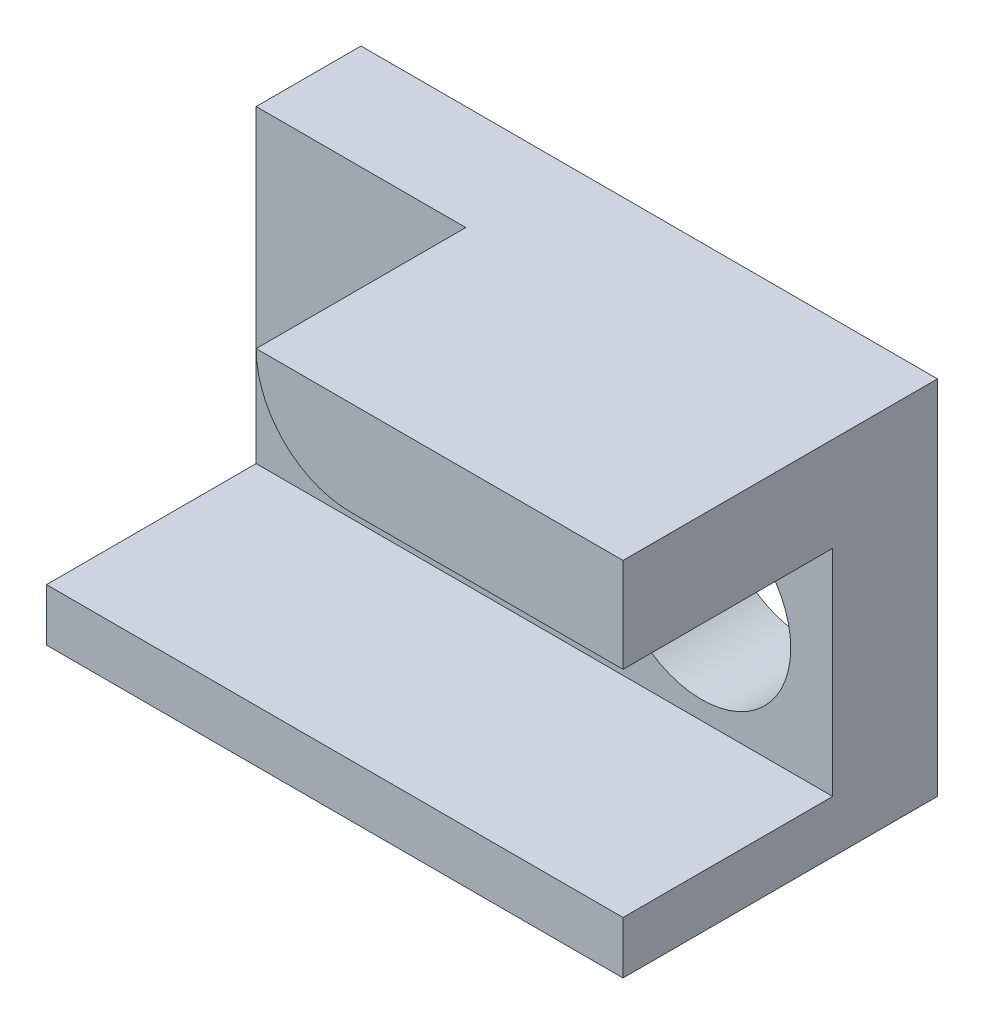
from build123d import *

# Parameters (mm, degrees)
BOSS_EXTRUDE1_DEPTH   = 4
SKETCH2_W             = 11
SKETCH2_H             = 1
BOSS_EXTRUDE1_2_DEPTH = 4
SKETCH3_W             = 11
SKETCH3_H             = 6.9
BOSS_EXTRUDE2_DEPTH   = 2
SKETCH5_R             = 1.7
CUT_EXTRUDE1_DEPTH    = 2


with BuildPart() as part:
    # Sketch2 → Boss-Extrude1 (new body)
    with BuildSketch(Plane.XY):
        with BuildLine():
            Line((-5, 4.1), (0, 4.1))
            Line((0, 4.1), (0, 5.1))
            Line((0, 5.1), (0, 5.9))
            Line((0, 5.9), (-5, 5.9))
            Line((-5, 5.9), (-7, 5.9))
            ThreePointArc((-7, 5.9), (-6.472792206, 4.627207794), (-5.2, 4.1))
            Line((-5.2, 4.1), (-5, 4.1))
        make_face()
    extrude(amount=BOSS_EXTRUDE1_DEPTH)



with BuildPart() as body_2:
    # Sketch2 → Boss-Extrude1 2 (new body)
    with BuildSketch(Plane.XY):
        with Locations((-5.5, -0.5)):
            Rectangle(SKETCH2_W, SKETCH2_H)
    extrude(amount=BOSS_EXTRUDE1_2_DEPTH)


with BuildPart() as part_1:
    add(part.part)

    add(body_2.part)  # Boss-Extrude2 merges body 2
    # Sketch3 → Boss-Extrude2 (add)
    with BuildSketch(Plane(origin=(0, 0, 0), x_dir=(-1, 0, 0), z_dir=(0, 0, -1))):
        with Locations((5.5, 2.45)):
            Rectangle(SKETCH3_W, SKETCH3_H)
    extrude(amount=BOSS_EXTRUDE2_DEPTH)

    # Sketch5 → Cut-Extrude1 (cut)
    with BuildSketch(Plane.XY):
        with Locations((-2.5, 2.05)):
            Circle(SKETCH5_R)
    extrude(amount=-CUT_EXTRUDE1_DEPTH, mode=Mode.SUBTRACT)


solid = part_1.part
